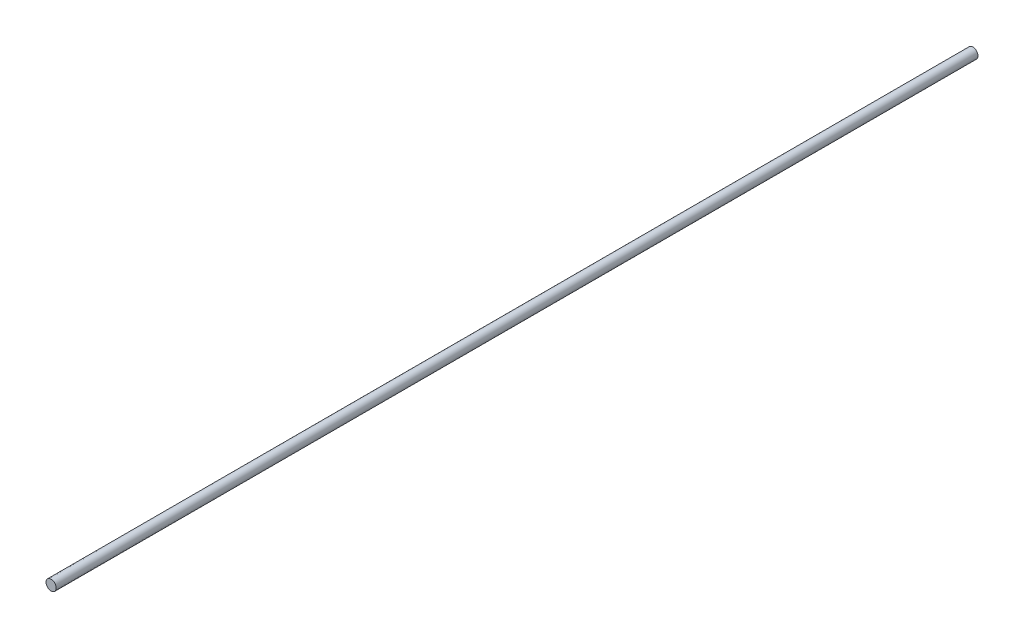
from build123d import *

# Parameters (mm, degrees)
ESQUISSE1_R        = 5
BOSS_EXTRU_1_DEPTH = 900


with BuildPart() as part:
    # Esquisse1 → Boss.-Extru.1 (new body)
    with BuildSketch(Plane.XY):
        Circle(ESQUISSE1_R)
    extrude(amount=BOSS_EXTRU_1_DEPTH)


solid = part.part
